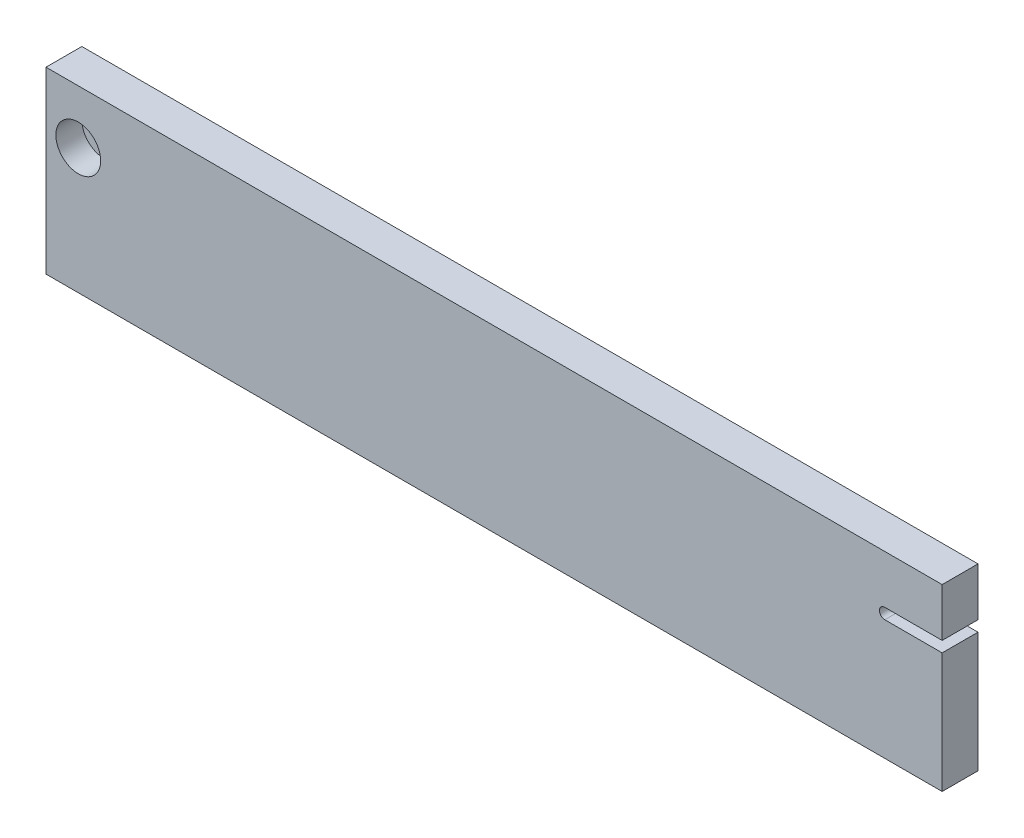
from build123d import *

# Parameters (mm, degrees)
SKETCH1_W           = 500
SKETCH1_H           = 100
BOSS_EXTRUDE1_DEPTH = 20
SKETCH2_R           = 3
CUT_EXTRUDE1_DEPTH  = 511.294032887
SKETCH3_R           = 12.5
CUT_EXTRUDE2_DEPTH  = 14.5
SKETCH4_R           = 3.5
CUT_EXTRUDE3_DEPTH  = 2.6
SKETCH5_R           = 1.5
CUT_EXTRUDE4_DEPTH  = 511.108076784


with BuildPart() as part:
    # Sketch1 → Boss-Extrude1 (new body)
    with BuildSketch(Plane.XY):
        with Locations((250, 50)):
            Rectangle(SKETCH1_W, SKETCH1_H)
    extrude(amount=BOSS_EXTRUDE1_DEPTH)

    # Sketch2 → Cut-Extrude1 (cut, through all)
    with BuildSketch(Plane.XY.offset(20)):
        with Locations((18, 70)):
            Circle(SKETCH2_R)
        with BuildLine():
            Line((468, 73), (520, 73))
            ThreePointArc((520, 73), (523, 70), (520, 67))
            Line((520, 67), (468, 67))
            ThreePointArc((468, 67), (465, 70), (468, 73))
        make_face()
    extrude(amount=-CUT_EXTRUDE1_DEPTH, mode=Mode.SUBTRACT)

    # Sketch3 → Cut-Extrude2 (cut)
    with BuildSketch(Plane.XY.offset(20)):
        with Locations((18, 70)):
            Circle(SKETCH3_R)
    extrude(amount=-CUT_EXTRUDE2_DEPTH, mode=Mode.SUBTRACT)

    # Sketch4 → Cut-Extrude3 (cut)
    with BuildSketch(Plane.XY.offset(5.5)):
        with Locations((18, 70)):
            Circle(SKETCH4_R)
    extrude(amount=-CUT_EXTRUDE3_DEPTH, mode=Mode.SUBTRACT)

    # Sketch5 → Cut-Extrude4 (cut, through all)
    with BuildSketch(Plane.XY.offset(5.5)):
        with Locations((18, 61.5)):
            Circle(SKETCH5_R)
        with Locations((18, 78.5)):
            Circle(SKETCH5_R)
    extrude(amount=-CUT_EXTRUDE4_DEPTH, mode=Mode.SUBTRACT)


solid = part.part
